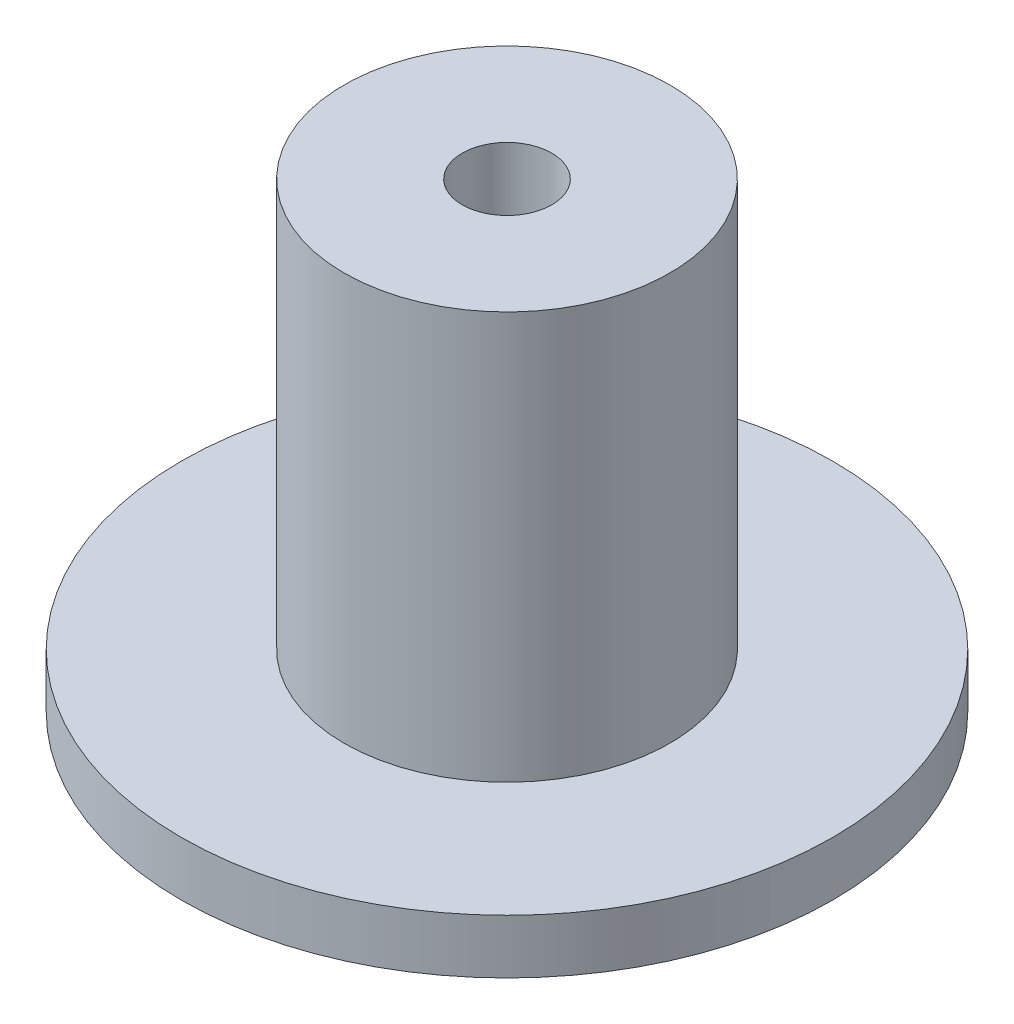
from build123d import *

# Parameters (mm, degrees)
M4X0_7_TAPPED_HOLE1_D     = 3.3
M4X0_7_TAPPED_HOLE1_DEPTH = 10.1
M4X0_7_TAPPED_HOLE1_TIP   = 0.991420021


with BuildPart() as part:
    # Sketch1 → Revolve1 (revolve)
    with BuildSketch(Plane.XY):
        with BuildLine():
            Line((0, 0), (-2, 0))
            ThreePointArc((-2, 0), (-7.099019514, 0.504902432), (-12, 2))
            Line((-12, 2), (-12, 4))
            Line((-12, 4), (-6, 4))
            Line((-6, 4), (-6, 19))
            Line((-6, 19), (0, 19))
            Line((0, 19), (0, 0))
        make_face()
    revolve(axis=Axis((0, -1.785426229, 0), (0, 1, 0)))

    # M4x0.7 Tapped Hole1
    with Locations(Plane(origin=(0, 19, 0), x_dir=(1, 0, 0), z_dir=(0, 1, 0))):
        with Locations((0, 0)):
            Hole(M4X0_7_TAPPED_HOLE1_D / 2, depth=M4X0_7_TAPPED_HOLE1_DEPTH)
            with Locations((0, 0, -(M4X0_7_TAPPED_HOLE1_DEPTH + M4X0_7_TAPPED_HOLE1_TIP / 2))):  # 118° drill point
                Cone(0, M4X0_7_TAPPED_HOLE1_D / 2, M4X0_7_TAPPED_HOLE1_TIP, mode=Mode.SUBTRACT)


solid = part.part
